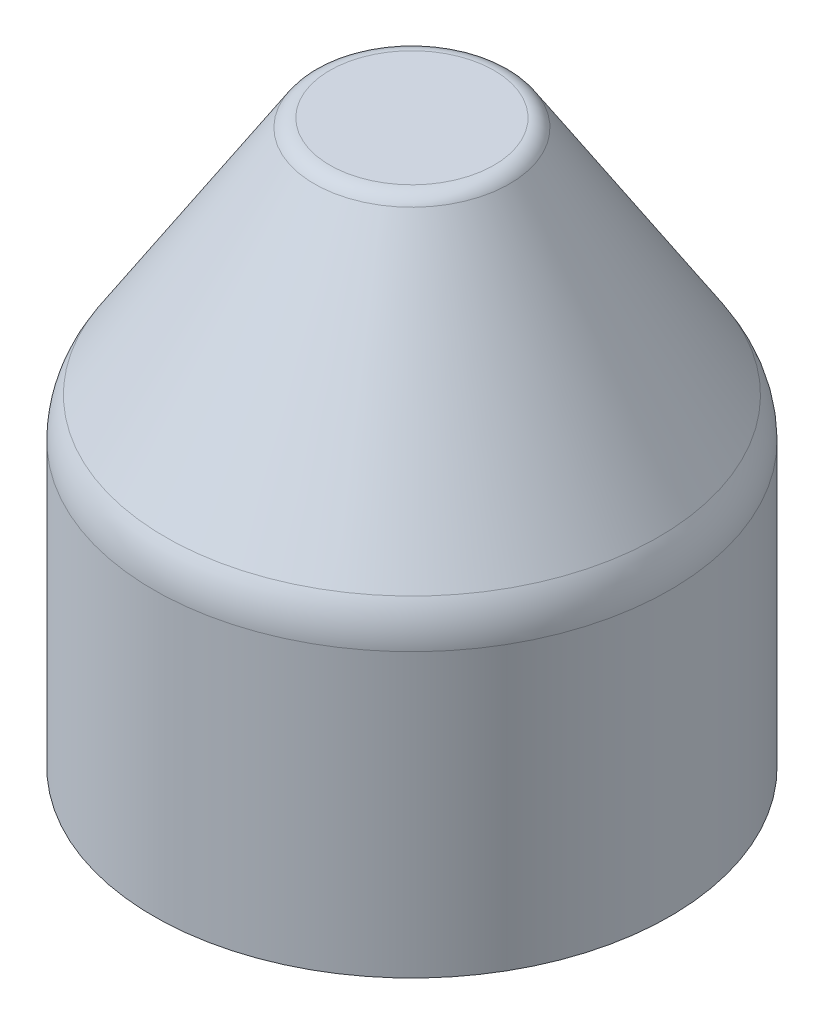
from build123d import *


with BuildPart() as part:
    # Sketch1 → Revolve1 (revolve)
    with BuildSketch(Plane.XY, mode=Mode.PRIVATE) as revolve1_sk:
        with BuildLine():
            Line((0, 32), (4.454048787, 32))
            ThreePointArc((4.454048787, 32), (4.933236855, 31.877712251), (5.295227263, 31.540757591))
            Line((5.295227263, 31.540757591), (13.364713902, 18.98822282))
            ThreePointArc((13.364713902, 18.98822282), (13.837893667, 17.952389064), (14, 16.825192455))
            Line((14, 16.825192455), (14, 1.5))
            Line((14, 1.5), (10.75, 0))
            Line((10.75, 0), (10, 0))
            Line((10, 0), (10, 16))
            Line((10, 16), (3.8, 16))
            Line((3.8, 16), (3.8, 30))
            Line((3.8, 30), (0, 30))
            Line((0, 30), (0, 32))
        make_face()
    revolve(revolve1_sk.sketch.rotate(Axis((0, 0, 0), (0, 1, 0)), 90), axis=Axis((0, 0, 0), (0, 1, 0)))


solid = part.part
